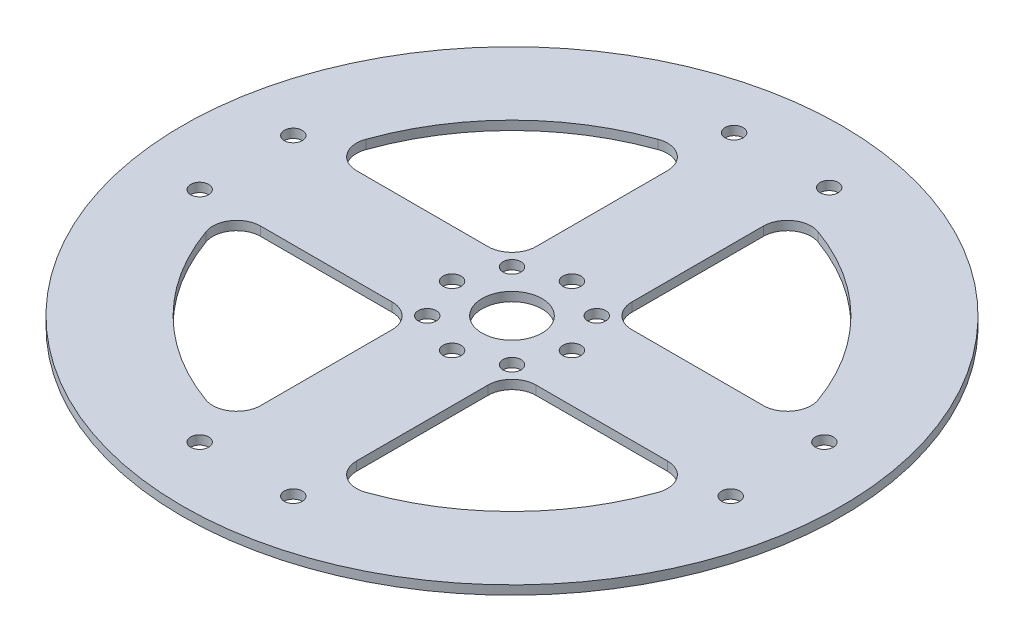
from build123d import *

# Parameters (mm, degrees)
SKETCH1_R           = 55
SKETCH1_R_2         = 5
BOSS_EXTRUDE1_DEPTH = 1.5
SKETCH2_R           = 1.5
CUT_EXTRUDE1_DEPTH  = 1.5


with BuildPart() as part:
    # Sketch1 → Boss-Extrude1 (new body)
    with BuildSketch(Plane(origin=(0, 0, 0), x_dir=(1, 0, 0), z_dir=(0, 1, 0))):
        with Locations(Location((0, 0, 0), (0, 0, 270))):
            Circle(SKETCH1_R)
        with Locations(Location((0, 0, 0), (0, 0, 270))):
            Circle(SKETCH1_R_2, mode=Mode.SUBTRACT)
        with BuildLine():
            Line((8, 33.941125497), (8, 12))
            ThreePointArc((8, 12), (9.171572875, 9.171572875), (12, 8))
            Line((12, 8), (33.941125497, 8))
            ThreePointArc((33.941125497, 8), (37.207111821, 9.690598923), (37.712361663, 13.333333333))
            ThreePointArc((37.712361663, 13.333333333), (28.284271247, 28.284271247), (13.333333333, 37.712361663))
            ThreePointArc((13.333333333, 37.712361663), (9.690598923, 37.207111821), (8, 33.941125497))
        make_face(mode=Mode.SUBTRACT)
        with BuildLine():
            Line((-33.941125497, 8), (-12, 8))
            ThreePointArc((-12, 8), (-9.171572875, 9.171572875), (-8, 12))
            Line((-8, 12), (-8, 33.941125497))
            ThreePointArc((-8, 33.941125497), (-9.690598923, 37.207111821), (-13.333333333, 37.712361663))
            ThreePointArc((-13.333333333, 37.712361663), (-28.284271247, 28.284271247), (-37.712361663, 13.333333333))
            ThreePointArc((-37.712361663, 13.333333333), (-37.207111821, 9.690598923), (-33.941125497, 8))
        make_face(mode=Mode.SUBTRACT)
        with BuildLine():
            Line((-33.941125497, -8), (-12, -8))
            ThreePointArc((-12, -8), (-9.171572875, -9.171572875), (-8, -12))
            Line((-8, -12), (-8, -33.941125497))
            ThreePointArc((-8, -33.941125497), (-9.690598923, -37.207111821), (-13.333333333, -37.712361663))
            ThreePointArc((-13.333333333, -37.712361663), (-28.284271247, -28.284271247), (-37.712361663, -13.333333333))
            ThreePointArc((-37.712361663, -13.333333333), (-37.207111821, -9.690598923), (-33.941125497, -8))
        make_face(mode=Mode.SUBTRACT)
        with BuildLine():
            Line((12, -8), (33.941125497, -8))
            ThreePointArc((33.941125497, -8), (37.207111821, -9.690598923), (37.712361663, -13.333333333))
            ThreePointArc((37.712361663, -13.333333333), (28.284271247, -28.284271247), (13.333333333, -37.712361663))
            ThreePointArc((13.333333333, -37.712361663), (9.690598923, -37.207111821), (8, -33.941125497))
            Line((8, -33.941125497), (8, -12))
            ThreePointArc((8, -12), (9.171572875, -9.171572875), (12, -8))
        make_face(mode=Mode.SUBTRACT)
    extrude(amount=-BOSS_EXTRUDE1_DEPTH)

    # Sketch2 → Cut-Extrude1 (cut)
    with BuildSketch(Plane(origin=(0, 0, 0), x_dir=(1, 0, 0), z_dir=(0, 1, 0))):
        with Locations(Location((10, 0, 0), (0, 0, 270))):
            Circle(SKETCH2_R)
        with Locations(Location((7.071067812, -7.071067812, 0), (0, 0, 270))):
            Circle(SKETCH2_R)
        with Locations(Location((0, -10, 0), (0, 0, 270))):
            Circle(SKETCH2_R)
        with Locations(Location((-7.071067812, -7.071067812, 0), (0, 0, 270))):
            Circle(SKETCH2_R)
        with Locations(Location((-10, 0, 0), (0, 0, 270))):
            Circle(SKETCH2_R)
        with Locations(Location((-7.071067812, 7.071067812, 0), (0, 0, 270))):
            Circle(SKETCH2_R)
        with Locations(Location((0, 10, 0), (0, 0, 270))):
            Circle(SKETCH2_R)
        with Locations(Location((7.071067812, 7.071067812, 0), (0, 0, 270))):
            Circle(SKETCH2_R)
        with Locations(Location((-44.316348886, 7.814167995, 0), (0, 0, 270))):
            Circle(SKETCH2_R)
        with Locations(Location((-44.316348886, -7.814167995, 0), (0, 0, 90))):
            Circle(SKETCH2_R)
        with Locations(Location((7.934714132, 45, 0), (0, 0, 270))):
            Circle(SKETCH2_R)
        with Locations(Location((-7.934714132, 45, 0), (0, 0, 90))):
            Circle(SKETCH2_R)
        with Locations(Location((44.316348886, -7.814167995, 0), (0, 0, 270))):
            Circle(SKETCH2_R)
        with Locations(Location((44.316348886, 7.814167995, 0), (0, 0, 90))):
            Circle(SKETCH2_R)
        with Locations(Location((-7.814167995, -44.316348886, 0), (0, 0, 270))):
            Circle(SKETCH2_R)
        with Locations(Location((7.814167995, -44.316348886, 0), (0, 0, 90))):
            Circle(SKETCH2_R)
    extrude(amount=-CUT_EXTRUDE1_DEPTH, mode=Mode.SUBTRACT)


solid = part.part
